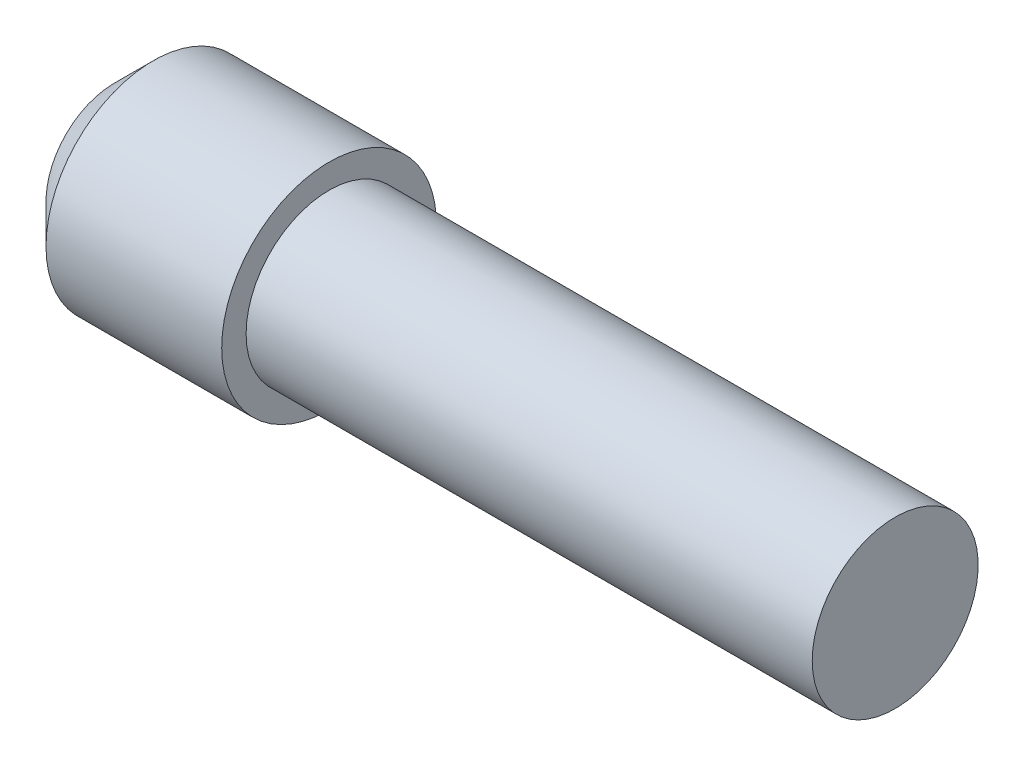
from build123d import *

# Parameters (mm, degrees)
CHAMFER1_SIZE = 1


with BuildPart() as part:
    # Sketch1 → Revolve1 (revolve)
    with BuildSketch(Plane.XY, mode=Mode.PRIVATE) as revolve1_sk:
        Polygon((0, 2.75), (-5.5, 2.75), (-5.5, 0), (14.5, 0), (14.5, 2.125), (0, 2.125), align=None)
    revolve(revolve1_sk.sketch.rotate(Axis((-9.458937198, 0, 0), (1, 0, 0)), 90), axis=Axis((-9.458937198, 0, 0), (1, 0, 0)))

    # Chamfer1
    chamfer1_edges = [part.edges().sort_by_distance(p)[0] for p in [
        (-5.5, 0, -2.75),
    ]]
    chamfer(chamfer1_edges, length=CHAMFER1_SIZE)


solid = part.part
